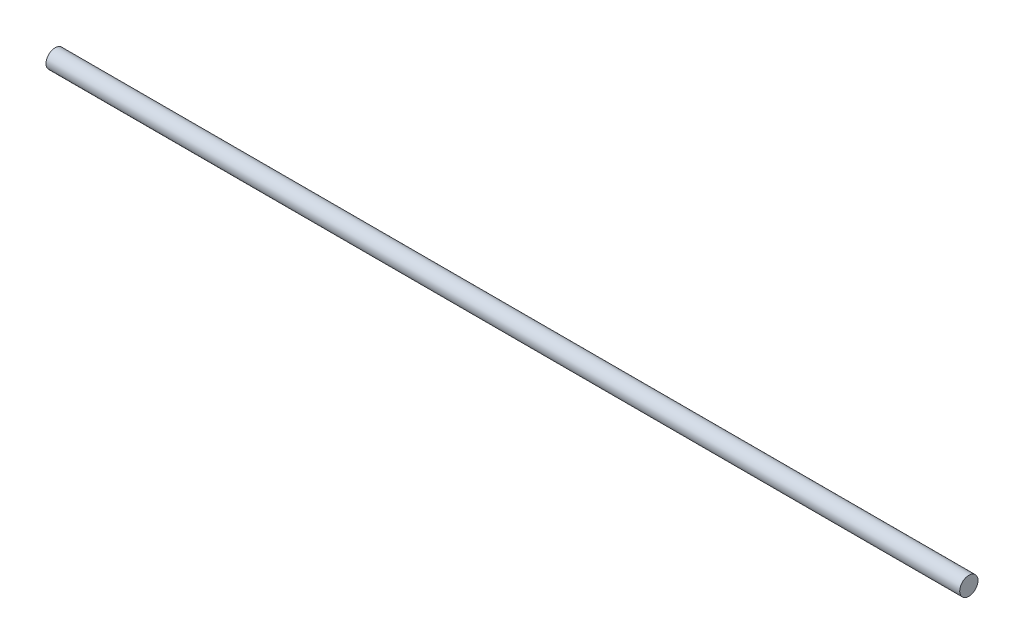
from build123d import *

# Parameters (mm, degrees)
ESBO_O1_R                = 4
RESSALTO_EXTRUS_O1_DEPTH = 400


with BuildPart() as part:
    # Esboço1 → Ressalto-extrusão1 (new body)
    with BuildSketch(Plane(origin=(0, 0, 0), x_dir=(0, 0, -1), z_dir=(1, 0, 0))):
        Circle(ESBO_O1_R)
    extrude(amount=RESSALTO_EXTRUS_O1_DEPTH)


solid = part.part
